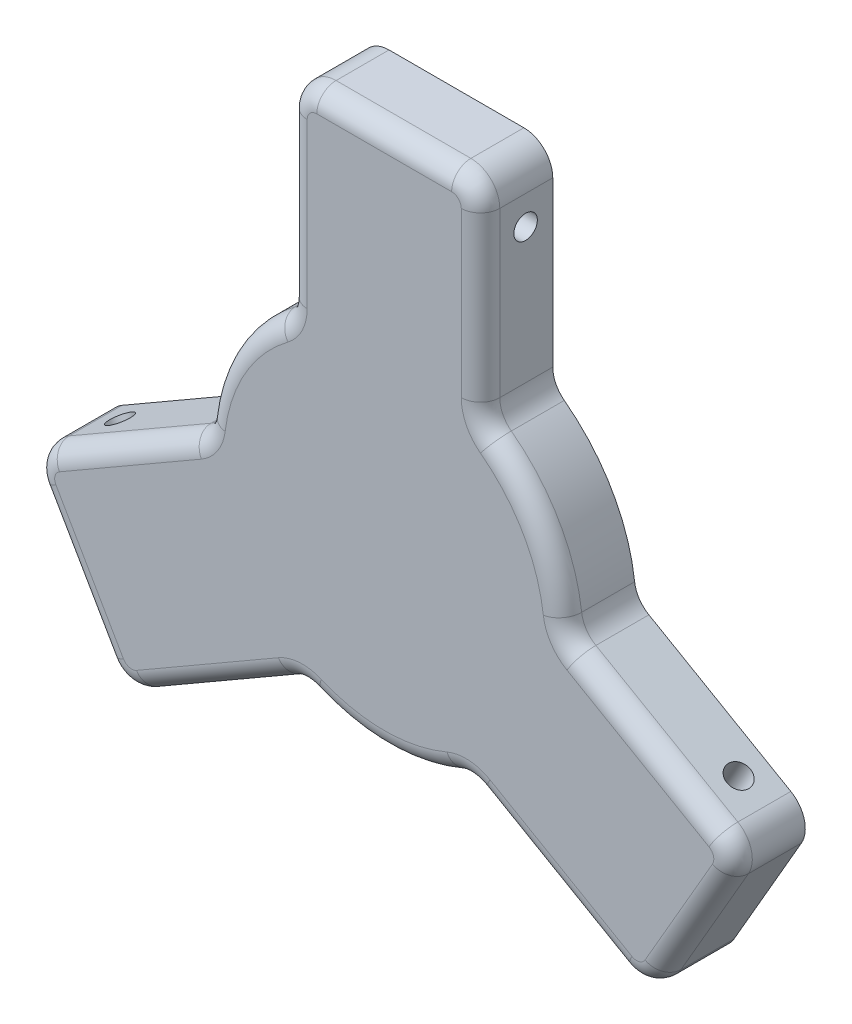
from build123d import *

# Parameters (mm, degrees)
BOSS_EXTRUDE1_DEPTH = 9.525
FILLET1_R           = 2.54
SKETCH3_R           = 1.55
CUT_EXTRUDE2_DEPTH  = 5.08
CUT_EXTRUDE3_START  = -5.08
SKETCH4_R           = 1.55
CUT_EXTRUDE3_DEPTH  = 5.08
CIRPATTERN2_COUNT   = 3


with BuildPart() as part:
    # Sketch1 → Boss-Extrude1 (new body)
    with BuildSketch(Plane.XY):
        with BuildLine():
            Line((12.7, 21.969079793), (12.7, 43.5864))
            ThreePointArc((12.7, 43.5864), (11.584076836, 46.280476836), (8.89, 47.3964))
            Line((8.89, 47.3964), (-8.89, 47.3964))
            ThreePointArc((-8.89, 47.3964), (-11.584076836, 46.280476836), (-12.7, 43.5864))
            Line((-12.7, 43.5864), (-12.7, 21.969079793))
            ThreePointArc((-12.7, 21.969079793), (-13.101409662, 20.266842468), (-14.221056121, 18.923289925))
            ThreePointArc((-14.221056121, 18.923289925), (-20.499926929, 11.835638331), (-23.498577859, 2.854150907))
            ThreePointArc((-23.498577859, 2.854150907), (-24.102305263, 1.212732359), (-25.375781199, 0.013982731))
            Line((-25.375781199, 0.013982731), (-44.09692966, -10.794677372))
            ThreePointArc((-44.09692966, -10.794677372), (-45.872107058, -13.108133599), (-45.491486448, -15.99923416))
            Line((-45.491486448, -15.99923416), (-36.601486448, -31.39716584))
            ThreePointArc((-36.601486448, -31.39716584), (-34.288030221, -33.172343238), (-31.39692966, -32.791722628))
            Line((-31.39692966, -32.791722628), (-12.675781199, -21.983062525))
            ThreePointArc((-12.675781199, -21.983062525), (-11.000895601, -21.479574827), (-9.277521738, -21.777440832))
            ThreePointArc((-9.277521738, -21.777440832), (0, -23.671276662), (9.277521738, -21.777440832))
            ThreePointArc((9.277521738, -21.777440832), (11.000895601, -21.479574827), (12.675781199, -21.983062525))
            Line((12.675781199, -21.983062525), (31.39692966, -32.791722628))
            ThreePointArc((31.39692966, -32.791722628), (34.288030221, -33.172343238), (36.601486448, -31.39716584))
            Line((36.601486448, -31.39716584), (45.491486448, -15.99923416))
            ThreePointArc((45.491486448, -15.99923416), (45.872107058, -13.108133599), (44.09692966, -10.794677372))
            Line((44.09692966, -10.794677372), (25.375781199, 0.013982731))
            ThreePointArc((25.375781199, 0.013982731), (24.102305263, 1.212732359), (23.498577859, 2.854150907))
            ThreePointArc((23.498577859, 2.854150907), (20.499926929, 11.835638331), (14.221056121, 18.923289925))
            ThreePointArc((14.221056121, 18.923289925), (13.101409662, 20.266842468), (12.7, 21.969079793))
        make_face()
    extrude(amount=BOSS_EXTRUDE1_DEPTH)

    # Fillet1
    fillet1_edges = [part.edges().sort_by_distance(p)[0] for p in [
        (-11.584076836, 46.280476836, 9.525),
        (0, 47.3964, 9.525),
        (11.584076836, 46.280476836, 9.525),
        (12.7, 32.777739897, 9.525),
        (13.101409662, 20.266842468, 9.525),
        (20.499926929, 11.835638331, 9.525),
        (24.102305263, 1.212732359, 9.525),
        (34.736355429, -5.39034732, 9.525),
        (45.872107058, -13.108133599, 9.525),
        (41.046486448, -23.6982, 9.525),
        (34.288030221, -33.172343238, 9.525),
        (22.036355429, -27.387392576, 9.525),
        (11.000895601, -21.479574827, 9.525),
        (0, -23.671276662, 9.525),
        (-11.000895601, -21.479574827, 9.525),
        (-22.036355429, -27.387392576, 9.525),
        (-34.288030221, -33.172343238, 9.525),
        (-41.046486448, -23.6982, 9.525),
        (-45.872107058, -13.108133599, 9.525),
        (-34.736355429, -5.39034732, 9.525),
        (-24.102305263, 1.212732359, 9.525),
        (-20.499926929, 11.835638331, 9.525),
        (-13.101409662, 20.266842468, 9.525),
        (-12.7, 32.777739897, 9.525),
    ]]
    fillet(fillet1_edges, radius=FILLET1_R)

    # Sketch3 → Cut-Extrude2 (cut)
    with BuildSketch(Plane(origin=(-6.35, -10.998522628, 0), x_dir=(0.8660254037844575, -0.4999999999999674, 0), z_dir=(-0.4999999999999675, -0.8660254037844576, 0))):
        with Locations((39.7764, 3.582)):
            Circle(SKETCH3_R)
    cut_extrude2 = extrude(amount=-CUT_EXTRUDE2_DEPTH, mode=Mode.SUBTRACT)

    # Sketch4 → Cut-Extrude3 (cut)
    with BuildSketch(Plane(origin=(6.35, 10.998522628, 0), x_dir=(0.8660254037844387, -0.49999999999999983, 0), z_dir=(0.49999999999999983, 0.8660254037844387, 0)).offset(CUT_EXTRUDE3_START)):
        with Locations((39.7764, -3.582)):
            Circle(SKETCH4_R)
    cut_extrude3 = extrude(amount=CUT_EXTRUDE3_DEPTH, mode=Mode.SUBTRACT)

    # CirPattern2: Cut-Extrude2, Cut-Extrude3 ×3 about axis
    cirpattern2_axis = Axis((0, 0, 0), (0, 0, -1))
    add([cut_extrude2.rotate(cirpattern2_axis, i * 360 / CIRPATTERN2_COUNT) for i in range(1, CIRPATTERN2_COUNT)], mode=Mode.SUBTRACT)
    add([cut_extrude3.rotate(cirpattern2_axis, i * 360 / CIRPATTERN2_COUNT) for i in range(1, CIRPATTERN2_COUNT)], mode=Mode.SUBTRACT)


solid = part.part
